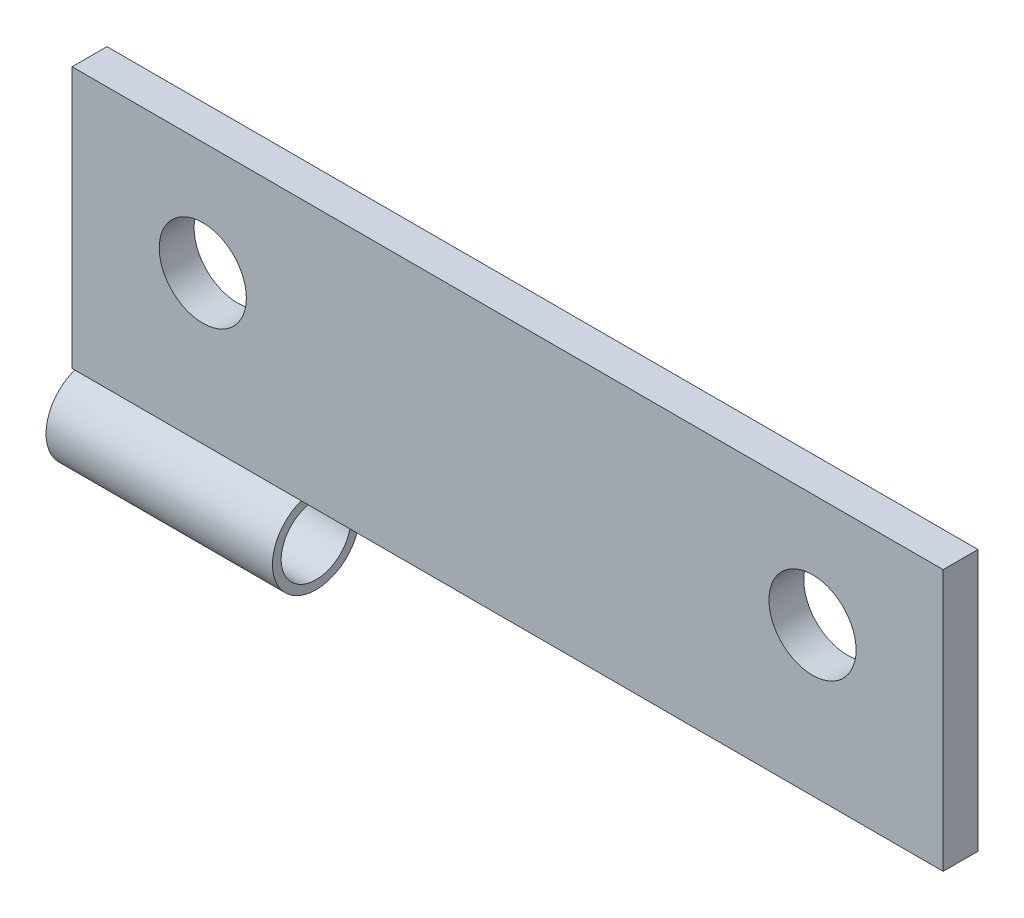
from build123d import *

# Parameters (mm, degrees)
ESQUISSE1_W             = 50
ESQUISSE1_H             = 15
BOSS_EXTRU_1_DEPTH      = 2
ESQUISSE2_R             = 2.5
BOSS_EXTRU_2_DEPTH      = 13
ESQUISSE3_R             = 2
ENL_V_MAT_EXTRU_1_DEPTH = 9
ESQUISSE4_R             = 2.5
ENL_V_MAT_EXTRU_2_DEPTH = 47.618550096


with BuildPart() as part:
    # Esquisse1 → Boss.-Extru.1 (new body)
    with BuildSketch(Plane.XY):
        with Locations((18.211903391, -4.639737991)):
            Rectangle(ESQUISSE1_W, ESQUISSE1_H)
    extrude(amount=-BOSS_EXTRU_1_DEPTH)

    # Esquisse4 → Enlèv. mat.-Extru.2 (cut, through all)
    with BuildSketch(Plane(origin=(0, 0, -2), x_dir=(-1, 0, 0), z_dir=(0, 0, -1))):
        with Locations((-35.711903391, -3.639737991)):
            Circle(ESQUISSE4_R)
        with Locations((-0.711903391, -3.639737991)):
            Circle(ESQUISSE4_R)
    extrude(amount=-ENL_V_MAT_EXTRU_2_DEPTH, mode=Mode.SUBTRACT)


with BuildPart() as body_2:
    # Esquisse2 → Boss.-Extru.2 (new body)
    with BuildSketch(Plane.ZY.offset(6.788096609)):
        with Locations((-1, -14.639737991)):
            Circle(ESQUISSE2_R)
    extrude(amount=-BOSS_EXTRU_2_DEPTH)

    # Esquisse3 → Enlèv. mat.-Extru.1 (cut)
    with BuildSketch(Plane(origin=(6.211903391, 0, 0), x_dir=(0, 0, -1), z_dir=(1, 0, 0))):
        with Locations((1, -14.639737991)):
            Circle(ESQUISSE3_R)
    extrude(amount=-ENL_V_MAT_EXTRU_1_DEPTH, mode=Mode.SUBTRACT)


solid = Compound([part.part, body_2.part])
